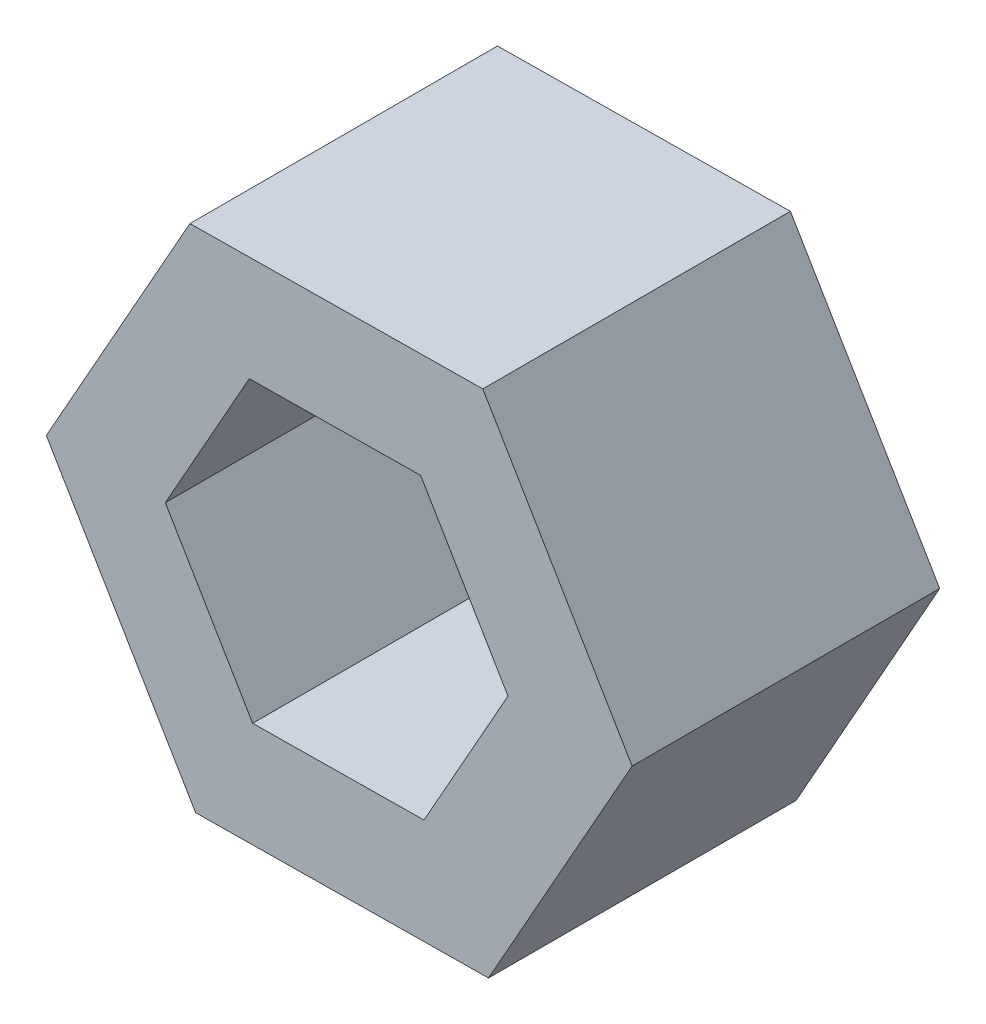
from build123d import *

# Parameters (mm, degrees)
BOSS_EXTRUDE1_DEPTH = 4.85
CUT_EXTRUDE1_DEPTH  = 13.74613412


with BuildPart() as part:
    # Sketch2 → Boss-Extrude1 (new body)
    with BuildSketch(Plane.XY):
        Polygon((-8.554474307, -3.585331143), (-3.935962323, -3.533558618), (-1.671542654, 0.49207635), (-4.025634968, 4.465938792), (-8.644146951, 4.414166267), (-10.90856662, 0.388531299), align=None)
    extrude(amount=BOSS_EXTRUDE1_DEPTH)

    # Sketch3 → Cut-Extrude1 (cut, through all)
    with BuildSketch(Plane.XY.offset(4.85)):
        Polygon((-4.952982971, -1.884854907), (-3.628297465, 0.47014155), (-5.005441468, 2.794851079), (-7.707270978, 2.764564151), (-9.031956485, 0.409567695), (-7.654812481, -1.915141834), align=None)
    extrude(amount=-CUT_EXTRUDE1_DEPTH, mode=Mode.SUBTRACT)


solid = part.part
